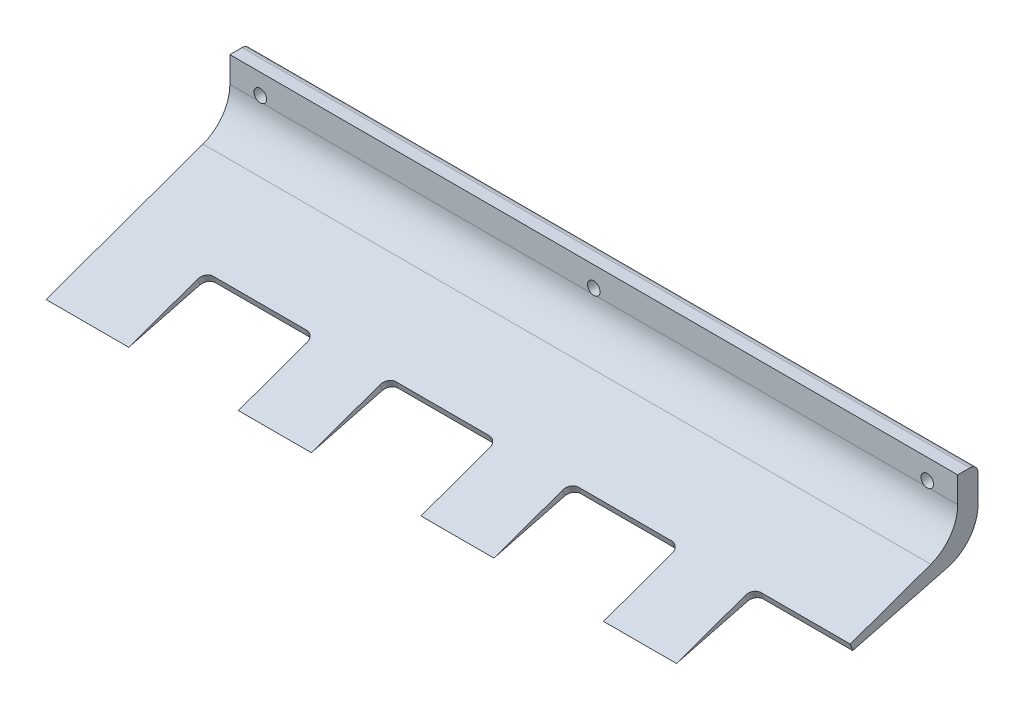
from build123d import *

# Parameters (mm, degrees)
BOSS_EXTRUDE1_DEPTH = 179.4
FILLET1_R           = 10
FILLET3_R           = 2
SKETCH3_R           = 1.55
CUT_EXTRUDE2_DEPTH  = 10
CUT_EXTRUDE4_REACH  = 187.252
SKETCH6_W           = 27
SKETCH6_H           = 20
FILLET4_R           = 2


with BuildPart() as part:
    # Sketch1 → Boss-Extrude1 (new body)
    with BuildSketch(Plane(origin=(0, 0, 0), x_dir=(0, 0, -1), z_dir=(1, 0, 0))):
        Polygon((-2.5, 26.138937515), (-2.5, 12.731613167), (-47.815237798, -3.479647722), (2.5, 9.546261863), (2.5, 26.138937515), align=None)
    extrude(amount=BOSS_EXTRUDE1_DEPTH)

    # Fillet1
    fillet1_edges = [part.edges().sort_by_distance(p)[0] for p in [
        (89.7, 12.731613167, 2.5),
        (89.7, 9.546261863, -2.5),
    ]]
    fillet(fillet1_edges, radius=FILLET1_R)

    # Fillet3
    fillet3_edges = [part.edges().sort_by_distance(p)[0] for p in [
        (89.7, 26.138937515, -2.5),
    ]]
    fillet(fillet3_edges, radius=FILLET3_R)

    # Sketch3 → Cut-Extrude2 (cut, symmetric)
    with BuildSketch(Plane.XY.offset(2.5)):
        with Locations(Location((7.5, 21.138937515, 0), (0, 0, 298.348188053))):
            Circle(SKETCH3_R)
        with Locations(Location((171.9, 21.138937515, 0), (0, 0, 298.348188053))):
            Circle(SKETCH3_R)
        with Locations(Location((89.7, 21.138937515, 0), (0, 0, 298.348188053))):
            Circle(SKETCH3_R)
    extrude(amount=CUT_EXTRUDE2_DEPTH, both=True, mode=Mode.SUBTRACT)

    # Sketch6 → Cut-Extrude4 (cut, up to next)
    with BuildSketch(Plane(origin=(0, 12.079968612, 4.321538013), x_dir=(1, 0, 0), z_dir=(0, 0.9415624549372754, 0.33683845304907145)), mode=Mode.PRIVATE) as cut_extrude4_sk1:
        with Locations((168.9, -36.19311184)):
            Rectangle(SKETCH6_W, SKETCH6_H)
    cut_extrude4_tool1 = extrude(cut_extrude4_sk1.sketch, amount=-CUT_EXTRUDE4_REACH, mode=Mode.PRIVATE) & part.part
    # Sketch6 → Cut-Extrude4 (cut, up to next)
    with BuildSketch(Plane(origin=(0, 12.079968612, 4.321538013), x_dir=(1, 0, 0), z_dir=(0, 0.9415624549372754, 0.33683845304907145)), mode=Mode.PRIVATE) as cut_extrude4_sk2:
        with Locations((123.9, -36.19311184)):
            Rectangle(SKETCH6_W, SKETCH6_H)
    cut_extrude4_tool2 = extrude(cut_extrude4_sk2.sketch, amount=-CUT_EXTRUDE4_REACH, mode=Mode.PRIVATE) & part.part
    # Sketch6 → Cut-Extrude4 (cut, up to next)
    with BuildSketch(Plane(origin=(0, 12.079968612, 4.321538013), x_dir=(1, 0, 0), z_dir=(0, 0.9415624549372754, 0.33683845304907145)), mode=Mode.PRIVATE) as cut_extrude4_sk3:
        with Locations((78.9, -36.19311184)):
            Rectangle(SKETCH6_W, SKETCH6_H)
    cut_extrude4_tool3 = extrude(cut_extrude4_sk3.sketch, amount=-CUT_EXTRUDE4_REACH, mode=Mode.PRIVATE) & part.part
    # Sketch6 → Cut-Extrude4 (cut, up to next)
    with BuildSketch(Plane(origin=(0, 12.079968612, 4.321538013), x_dir=(1, 0, 0), z_dir=(0, 0.9415624549372754, 0.33683845304907145)), mode=Mode.PRIVATE) as cut_extrude4_sk4:
        with Locations((33.9, -36.19311184)):
            Rectangle(SKETCH6_W, SKETCH6_H)
    cut_extrude4_tool4 = extrude(cut_extrude4_sk4.sketch, amount=-CUT_EXTRUDE4_REACH, mode=Mode.PRIVATE) & part.part
    add(cut_extrude4_tool1.solids().sort_by_distance((168.9, -0.111263, 38.399613))[0], mode=Mode.SUBTRACT)
    add(cut_extrude4_tool2.solids().sort_by_distance((123.9, -0.111263, 38.399613))[0], mode=Mode.SUBTRACT)
    add(cut_extrude4_tool3.solids().sort_by_distance((78.9, -0.111263, 38.399613))[0], mode=Mode.SUBTRACT)
    add(cut_extrude4_tool4.solids().sort_by_distance((33.9, -0.111263, 38.399613))[0], mode=Mode.SUBTRACT)

    # Fillet4
    fillet4_edges = [part.edges().sort_by_distance(p)[0] for p in [
        (155.4, 2.405209731, 28.679222311),
        (110.4, 2.405209731, 28.679222311),
        (137.4, 2.405209731, 28.679222311),
        (65.4, 2.405209731, 28.679222311),
        (92.4, 2.405209731, 28.679222311),
        (20.4, 2.405209731, 28.679222311),
        (47.4, 2.405209731, 28.679222311),
    ]]
    fillet(fillet4_edges, radius=FILLET4_R)


solid = part.part
